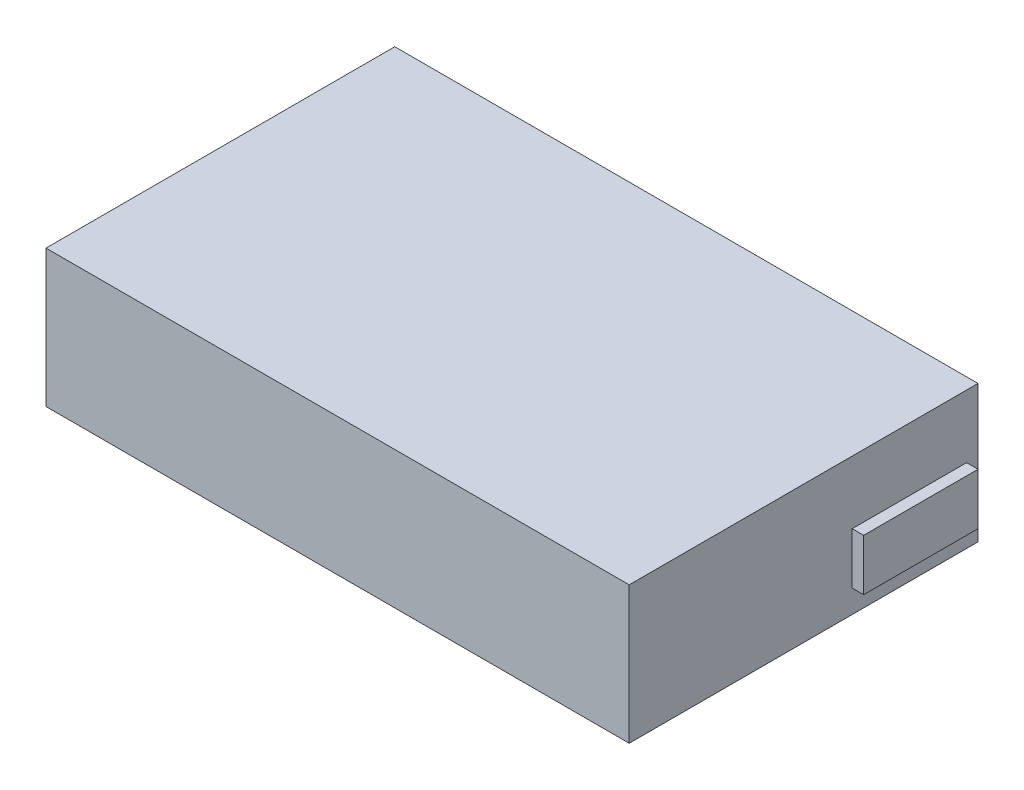
from build123d import *

# Parameters (mm, degrees)
CROQUIS1_W              = 102
CROQUIS1_H              = 61
SALIENTE_EXTRUIR1_DEPTH = 24
CROQUIS2_W              = 20
CROQUIS2_H              = 9
SALIENTE_EXTRUIR2_DEPTH = 2


with BuildPart() as part:
    # Croquis1 → Saliente-Extruir1 (new body)
    with BuildSketch(Plane(origin=(0, 0, 0), x_dir=(1, 0, 0), z_dir=(0, 1, 0))):
        Rectangle(CROQUIS1_W, CROQUIS1_H)
    extrude(amount=SALIENTE_EXTRUIR1_DEPTH)

    # Croquis2 → Saliente-Extruir2 (add)
    with BuildSketch(Plane(origin=(51, 0, 0), x_dir=(0, 0, -1), z_dir=(1, 0, 0))):
        with Locations((18.5, 8.5)):
            Rectangle(CROQUIS2_W, CROQUIS2_H)
    extrude(amount=SALIENTE_EXTRUIR2_DEPTH)


solid = part.part
